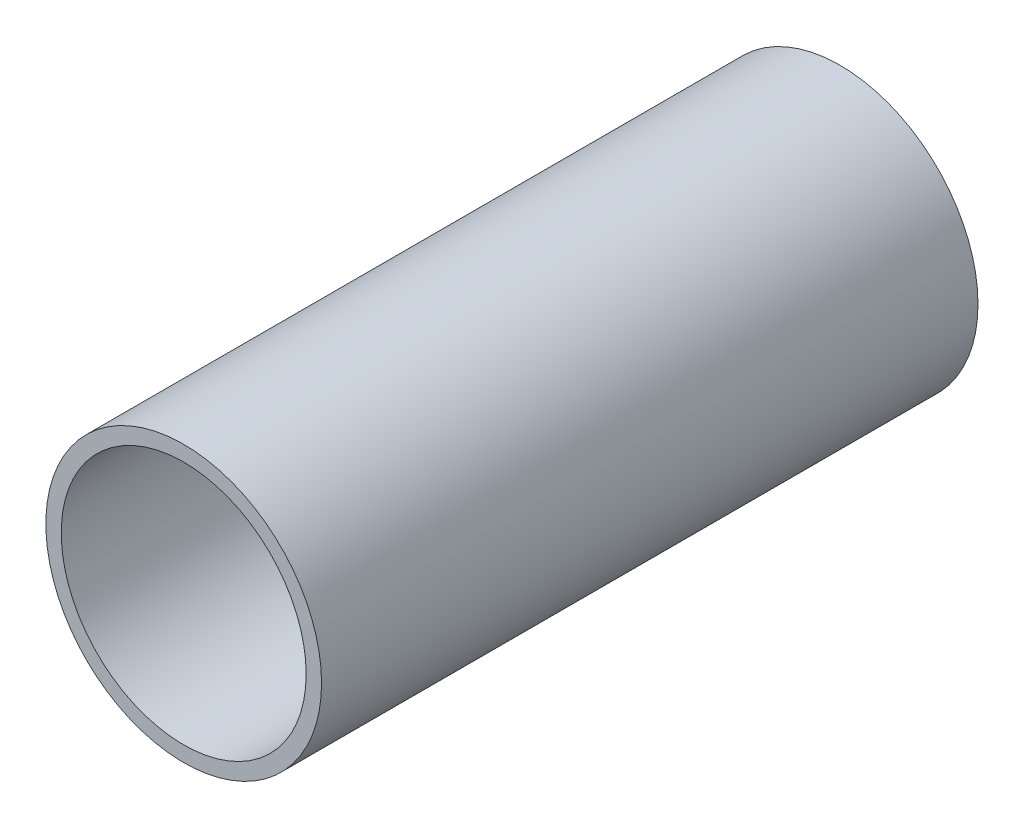
from build123d import *

# Parameters (mm, degrees)
ESQUISSE2_R        = 21
ESQUISSE2_R_2      = 18.655787326
BOSS_EXTRU_2_DEPTH = 100


with BuildPart() as part:
    # Esquisse2 → Boss.-Extru.2 (new body)
    with BuildSketch(Plane.XY):
        Circle(ESQUISSE2_R)
        Circle(ESQUISSE2_R_2, mode=Mode.SUBTRACT)
    extrude(amount=BOSS_EXTRU_2_DEPTH)


solid = part.part
